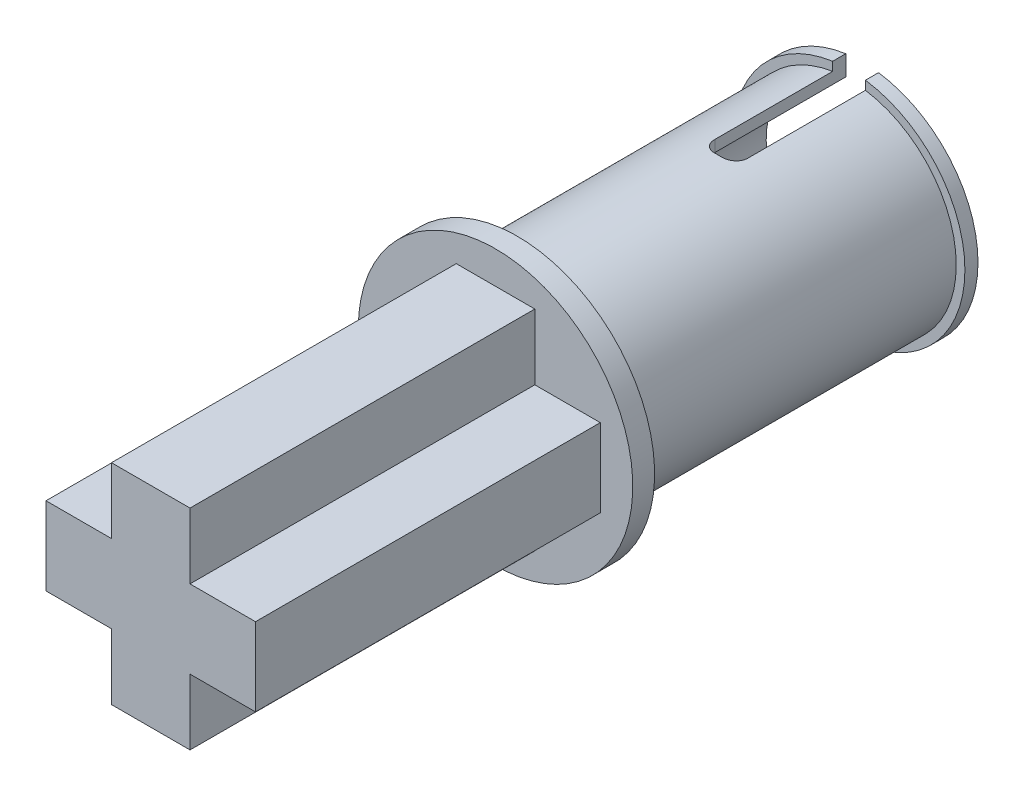
from build123d import *

# Parameters (mm, degrees)
BOSS_EXTRUDE1_DEPTH = 7.9
SKETCH2_R           = 3.144549921
BOSS_EXTRUDE3_DEPTH = 0.5
SKETCH3_R           = 2.455888386
BOSS_EXTRUDE4_DEPTH = 7.9
SKETCH4_R           = 2.65462565
BOSS_EXTRUDE5_DEPTH = 0.3
SKETCH5_R           = 2.198604039
CUT_EXTRUDE1_DEPTH  = 7.9
CUT_EXTRUDE2_DEPTH  = 3.3
FILLET1_R           = 0.3


with BuildPart() as part:
    # Sketch1 → Boss-Extrude1 (new body)
    with BuildSketch(Plane.XY):
        Polygon((-2.4, 0.895), (-2.4, 0), (0, 0), (0, 2.4), (-0.9, 2.4), (-0.9, 0.895), align=None)
        Polygon((0, 0), (-2.4, 0), (-2.4, -0.895), (-0.9, -0.895), (-0.9, -2.4), (0, -2.4), align=None)
        Polygon((0, 2.4), (0, 0), (2.4, 0), (2.4, 0.895), (0.9, 0.895), (0.9, 2.4), align=None)
        Polygon((2.4, 0), (0, 0), (0, -2.4), (0.9, -2.4), (0.9, -0.895), (2.4, -0.895), align=None)
    extrude(amount=BOSS_EXTRUDE1_DEPTH)

    # Sketch2 → Boss-Extrude3 (add)
    with BuildSketch(Plane(origin=(0, 0, 0), x_dir=(-1, 0, 0), z_dir=(0, 0, -1))):
        Circle(SKETCH2_R)
    extrude(amount=BOSS_EXTRUDE3_DEPTH)

    # Sketch3 → Boss-Extrude4 (add)
    with BuildSketch(Plane(origin=(0, 0, -0.5), x_dir=(-1, 0, 0), z_dir=(0, 0, -1))):
        Circle(SKETCH3_R)
    extrude(amount=BOSS_EXTRUDE4_DEPTH)

    # Sketch4 → Boss-Extrude5 (add)
    with BuildSketch(Plane(origin=(0, 0, -8.4), x_dir=(-1, 0, 0), z_dir=(0, 0, -1))):
        Circle(SKETCH4_R)
    extrude(amount=-BOSS_EXTRUDE5_DEPTH)

    # Sketch5 → Cut-Extrude1 (cut)
    with BuildSketch(Plane(origin=(0, 0, -8.4), x_dir=(-1, 0, 0), z_dir=(0, 0, -1))):
        Circle(SKETCH5_R)
    extrude(amount=-CUT_EXTRUDE1_DEPTH, mode=Mode.SUBTRACT)

    # Sketch6 → Cut-Extrude2 (cut)
    with BuildSketch(Plane(origin=(0, 0, -8.4), x_dir=(-1, 0, 0), z_dir=(0, 0, -1))):
        with BuildLine():
            Line((0.375484044, 2.166303638), (0.375484044, 2.627936276))
            ThreePointArc((0.375484044, 2.627936276), (0.188215694, 2.6479449), (0, 2.65462565))
            Line((0, 2.65462565), (0, 2.198604039))
            ThreePointArc((0, 2.198604039), (0.188435389, 2.190514055), (0.375484044, 2.166303638))
        make_face()
        with BuildLine():
            Line((0, 2.198604039), (0, 2.65462565))
            ThreePointArc((0, 2.65462565), (-0.188215694, 2.6479449), (-0.375484044, 2.627936276))
            Line((-0.375484044, 2.627936276), (-0.375484044, 2.166303638))
            ThreePointArc((-0.375484044, 2.166303638), (-0.188435389, 2.190514055), (0, 2.198604039))
        make_face()
        with BuildLine():
            ThreePointArc((0, -2.65462565), (0.188215694, -2.6479449), (0.375484044, -2.627936276))
            Line((0.375484044, -2.627936276), (0.375484044, -2.166303638))
            ThreePointArc((0.375484044, -2.166303638), (0, -2.198604039), (-0.375484044, -2.166303638))
            Line((-0.375484044, -2.166303638), (-0.375484044, -2.627936276))
            ThreePointArc((-0.375484044, -2.627936276), (-0.188215694, -2.6479449), (0, -2.65462565))
        make_face()
    extrude(amount=-CUT_EXTRUDE2_DEPTH, mode=Mode.SUBTRACT)

    # Fillet1
    fillet1_edges = [part.edges().sort_by_distance(p)[0] for p in [
        (0.375484044, 2.296659081, -5.1),
        (-0.375484044, 2.296659081, -5.1),
        (-0.375484044, -2.296659081, -5.1),
        (0.375484044, -2.296659081, -5.1),
    ]]
    fillet(fillet1_edges, radius=FILLET1_R)


solid = part.part
